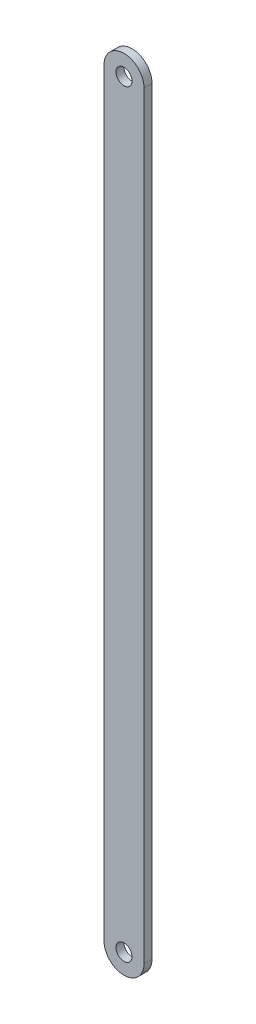
from build123d import *

# Parameters (mm, degrees)
CROQUIS1_R              = 10
SALIENTE_EXTRUIR1_DEPTH = 10


with BuildPart() as part:
    # Croquis1 → Saliente-Extruir1 (new body)
    with BuildSketch(Plane.XY):
        with BuildLine():
            Line((50, 0), (50, 945.2))
            ThreePointArc((50, 945.2), (25, 970.2), (0, 945.2))
            Line((0, 945.2), (0, 0))
            ThreePointArc((0, 0), (25, -25), (50, 0))
        make_face()
        with Locations((25, 945.2)):
            Circle(CROQUIS1_R, mode=Mode.SUBTRACT)
        with Locations((25, 0)):
            Circle(CROQUIS1_R, mode=Mode.SUBTRACT)
    extrude(amount=SALIENTE_EXTRUIR1_DEPTH)


solid = part.part
